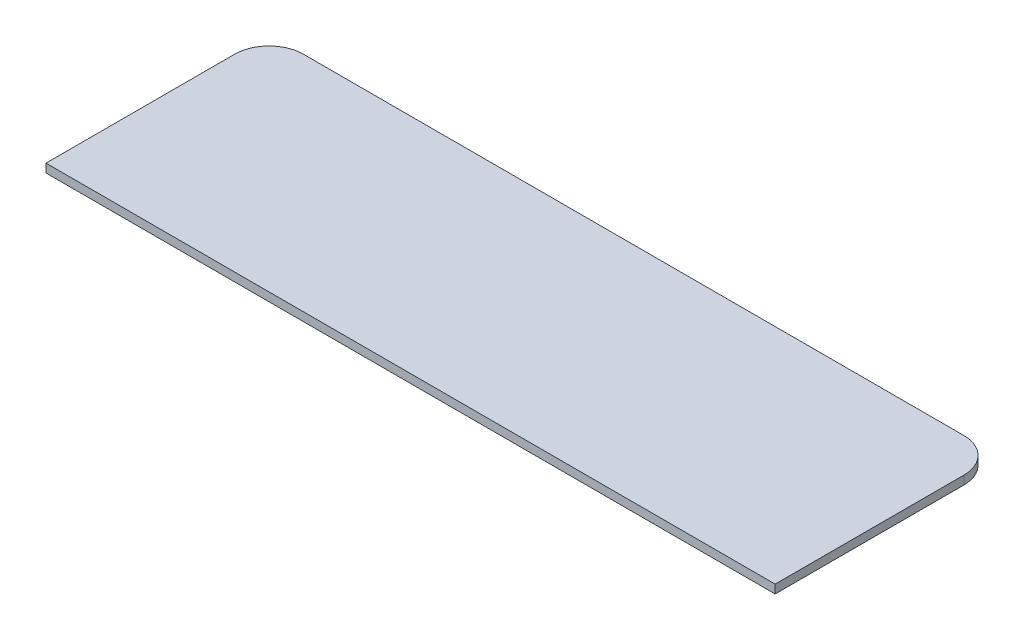
from build123d import *

# Parameters (mm, degrees)
BOSS_EXTRUDE1_DEPTH = 1


with BuildPart() as part:
    # Sketch1 → Boss-Extrude1 (new body)
    with BuildSketch(Plane(origin=(0, 0, 0), x_dir=(1, 0, 0), z_dir=(0, 1, 0))):
        with BuildLine():
            Line((-38.5, 13), (38.5, 13))
            ThreePointArc((38.5, 13), (41.328427125, 11.828427125), (42.5, 9))
            Line((42.5, 9), (42.5, -13))
            Line((42.5, -13), (-42.5, -13))
            Line((-42.5, -13), (-42.5, 9))
            ThreePointArc((-42.5, 9), (-41.328427125, 11.828427125), (-38.5, 13))
        make_face()
    extrude(amount=BOSS_EXTRUDE1_DEPTH)


solid = part.part
